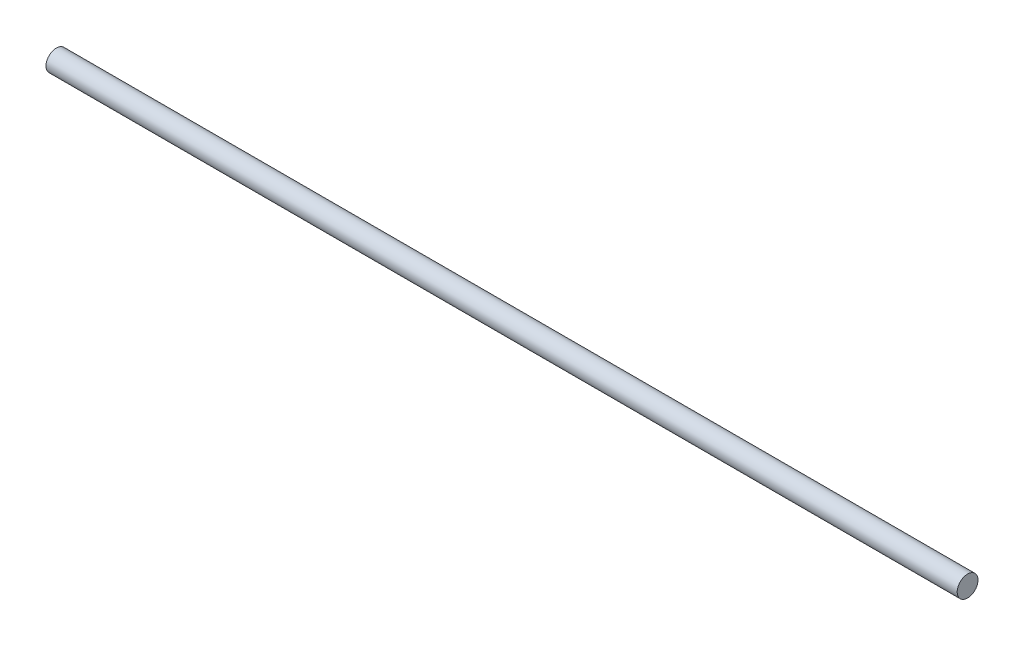
from build123d import *

# Parameters (mm, degrees)
SKETCH1_W = 350
SKETCH1_H = 4


with BuildPart() as part:
    # Sketch1 → Revolve1 (revolve)
    with BuildSketch(Plane.XY):
        with Locations((175, 2)):
            Rectangle(SKETCH1_W, SKETCH1_H)
    revolve(axis=Axis((0, 0, 0), (1, 0, 0)))


solid = part.part
